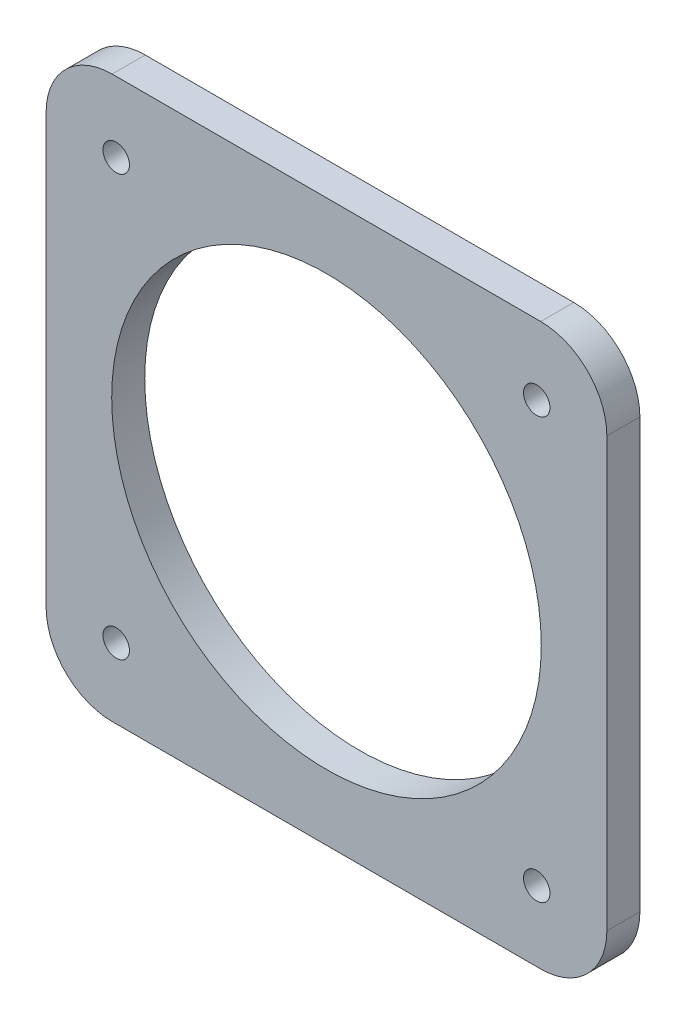
from build123d import *

# Parameters (mm, degrees)
SKETCH1_R           = 32.5
SKETCH1_R_2         = 2
BOSS_EXTRUDE2_DEPTH = 5


with BuildPart() as part:
    # Sketch1 → Boss-Extrude2 (new body)
    with BuildSketch(Plane.XY):
        with BuildLine():
            Line((-5.535475367, 65.430655792), (59.314524633, 65.430655792))
            ThreePointArc((59.314524633, 65.430655792), (66.385592445, 62.501723604), (69.314524633, 55.430655792))
            Line((69.314524633, 55.430655792), (69.314524633, -9.419344208))
            ThreePointArc((69.314524633, -9.419344208), (66.385592445, -16.49041202), (59.314524633, -19.419344208))
            Line((59.314524633, -19.419344208), (-5.535475367, -19.419344208))
            ThreePointArc((-5.535475367, -19.419344208), (-12.606543178, -16.49041202), (-15.535475367, -9.419344208))
            Line((-15.535475367, -9.419344208), (-15.535475367, 55.430655792))
            ThreePointArc((-15.535475367, 55.430655792), (-12.606543178, 62.501723604), (-5.535475367, 65.430655792))
        make_face()
        with Locations((26.889524633, 23.005655792)):
            Circle(SKETCH1_R, mode=Mode.SUBTRACT)
        with Locations((-4.925475367, 54.820655792)):
            Circle(SKETCH1_R_2, mode=Mode.SUBTRACT)
        with Locations((-4.925475367, -8.809344208)):
            Circle(SKETCH1_R_2, mode=Mode.SUBTRACT)
        with Locations((58.704524633, 54.820655792)):
            Circle(SKETCH1_R_2, mode=Mode.SUBTRACT)
        with Locations((58.704524633, -8.809344208)):
            Circle(SKETCH1_R_2, mode=Mode.SUBTRACT)
    extrude(amount=BOSS_EXTRUDE2_DEPTH)


solid = part.part
